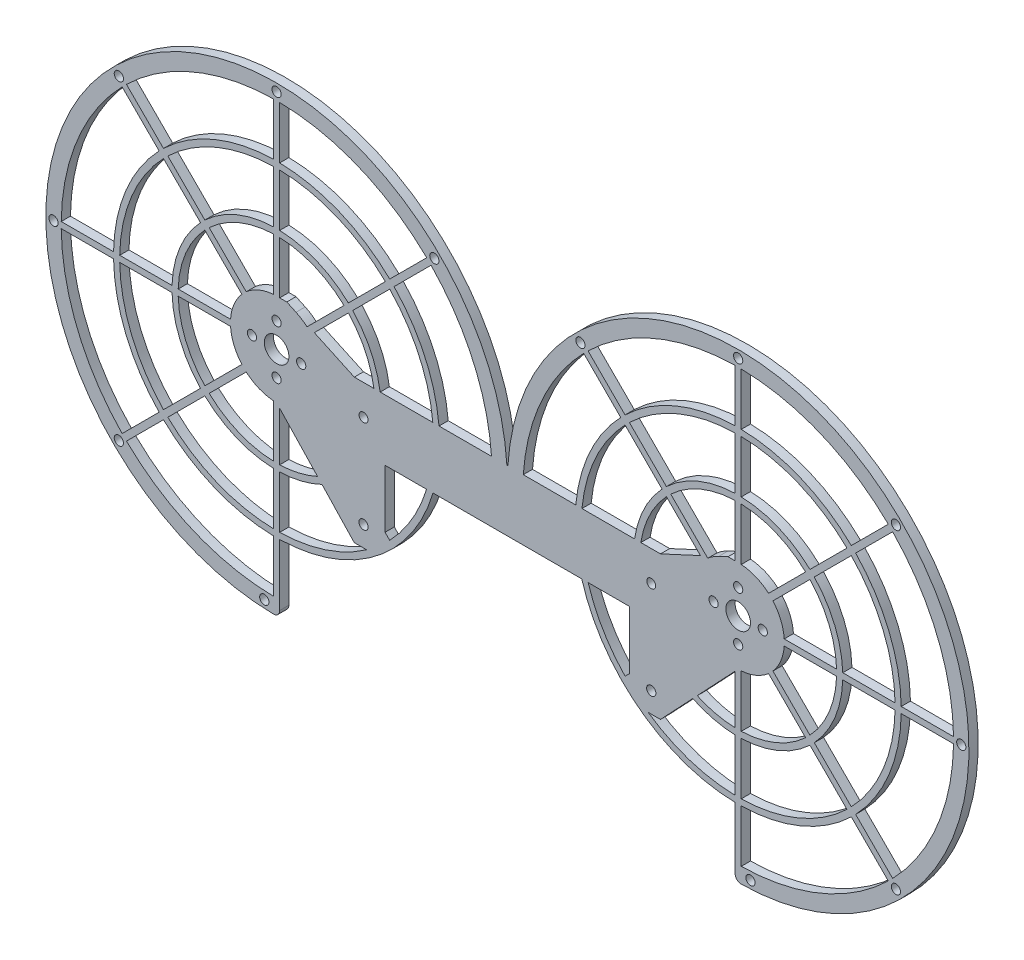
from build123d import *

# Parameters (mm, degrees)
SKETCH_1_R          = 1.5
SKETCH_1_R_2        = 4
SKETCH_1_R_3        = 1.459131994
EXTRUDE_1_DEPTH     = 3
SKETCH_5_R          = 1.5
CUT_EXTRUDE_2_DEPTH = 10
FILLET_1_R          = 2


with BuildPart() as part:
    # 草图1 → 凸台-拉伸1 (new body)
    with BuildSketch(Plane.XY):
        with BuildLine():
            Line((-125.75, -49.82198122), (-125.75, -27.819213381))
            ThreePointArc((-125.75, -27.819213381), (-94.617659732, -16.977345778), (-75.916939891, 10.171351817))
            Line((-75.916939891, 10.171351817), (-51.75, 10.171351817))
            Line((-51.75, 10.171351817), (-51.75, 30))
            Line((-51.75, 30), (-51.905600365, 30))
            ThreePointArc((-51.905600365, 30), (-181.804340524, 76.102870442), (-125.75, -49.82198122))
        make_face()
        with BuildLine():
            ThreePointArc((-127.75, -44.821504962), (-153.537840266, -39.500215459), (-175.535316881, -25.028178627))
            Line((-175.535316881, -25.028178627), (-163.512881209, -13.005742955))
            ThreePointArc((-163.512881209, -13.005742955), (-147.032221915, -23.794263406), (-127.75, -27.819213381))
            Line((-127.75, -27.819213381), (-127.75, -44.821504962))
        make_face(mode=Mode.SUBTRACT)
        with BuildLine():
            ThreePointArc((-127.75, -25.818843319), (-146.266855051, -21.946504341), (-162.098405973, -11.591267719))
            Line((-162.098405973, -11.591267719), (-150.0741229, 0.433015354))
            ThreePointArc((-150.0741229, 0.433015354), (-139.7612367, -6.240552289), (-127.75, -8.813939119))
            Line((-127.75, -8.813939119), (-127.75, -25.818843319))
        make_face(mode=Mode.SUBTRACT)
        with BuildLine():
            ThreePointArc((-176.949530444, -23.613965065), (-191.421567276, -1.616488449), (-196.742856778, 24.171351817))
            Line((-196.742856778, 24.171351817), (-179.740565198, 24.171351817))
            ThreePointArc((-179.740565198, 24.171351817), (-175.715615223, 4.889129901), (-164.927094772, -11.591529392))
            Line((-164.927094772, -11.591529392), (-176.949530444, -23.613965065))
        make_face(mode=Mode.SUBTRACT)
        with BuildLine():
            ThreePointArc((-163.512619536, -10.177054157), (-173.867856158, 5.654496766), (-177.740195136, 24.171351817))
            Line((-177.740195136, 24.171351817), (-160.735290936, 24.171351817))
            ThreePointArc((-160.735290936, 24.171351817), (-158.161904105, 12.160115116), (-151.488336463, 1.847228917))
            Line((-151.488336463, 1.847228917), (-163.512619536, -10.177054157))
        make_face(mode=Mode.SUBTRACT)
        with BuildLine():
            ThreePointArc((-127.75, -6.813019367), (-138.995869836, -4.392793224), (-148.659258975, 1.84787928))
            Line((-148.659258975, 1.84787928), (-136.625898463, 13.881239791))
            ThreePointArc((-136.625898463, 13.881239791), (-132.490251485, 11.313158829), (-127.75, 10.20472227))
            Line((-127.75, 10.20472227), (-127.75, -6.813019367))
        make_face(mode=Mode.SUBTRACT)
        with BuildLine():
            ThreePointArc((-150.073472537, 3.262092842), (-156.31414504, 12.925481981), (-158.734371183, 24.171351817))
            Line((-158.734371183, 24.171351817), (-141.716629547, 24.171351817))
            ThreePointArc((-141.716629547, 24.171351817), (-140.608192988, 19.431100331), (-138.040112025, 15.295453354))
            Line((-138.040112025, 15.295453354), (-150.073472537, 3.262092842))
        make_face(mode=Mode.SUBTRACT)
        with Locations((-134.75, 25.171351817)):
            Circle(SKETCH_1_R, mode=Mode.SUBTRACT)
        with BuildLine():
            ThreePointArc((-97.478573844, -16.592072502), (-110.926816524, -23.311911942), (-125.75, -25.818843319))
            Line((-125.75, -25.818843319), (-125.75, -8.813939119))
            ThreePointArc((-125.75, -8.813939119), (-118.698746874, -7.861621454), (-112.000098793, -5.462623021))
            Line((-112.000098793, -5.462623021), (-101.5, -16.592072502))
            Line((-101.5, -16.592072502), (-97.478573844, -16.592072502))
        make_face(mode=Mode.SUBTRACT)
        with Locations((-98.5, -10)):
            Circle(SKETCH_1_R, mode=Mode.SUBTRACT)
        with BuildLine():
            ThreePointArc((-113.444736922, -3.931396755), (-119.453694417, -5.985732849), (-125.75, -6.813019367))
            Line((-125.75, -6.813019367), (-125.75, 9.11141422))
            Line((-125.75, 9.11141422), (-113.444736922, -3.931396755))
        make_face(mode=Mode.SUBTRACT)
        with Locations((-126.75, 17.171351817)):
            Circle(SKETCH_1_R, mode=Mode.SUBTRACT)
        with Locations((-126.75, 25.171351817)):
            Circle(SKETCH_1_R_2, mode=Mode.SUBTRACT)
        with Locations((-118.75, 25.171351817)):
            Circle(SKETCH_1_R, mode=Mode.SUBTRACT)
        with Locations((-98.5, 20.171351817)):
            Circle(SKETCH_1_R_3, mode=Mode.SUBTRACT)
        with BuildLine():
            Line((-91.5, 10.171351817), (-78.005769572, 10.171351817))
            ThreePointArc((-78.005769572, 10.171351817), (-82.802647929, -0.705862985), (-89.987380464, -10.177054157))
            Line((-89.987380464, -10.177054157), (-91.5, -8.664434621))
            Line((-91.5, -8.664434621), (-91.5, 10.171351817))
        make_face(mode=Mode.SUBTRACT)
        with BuildLine():
            ThreePointArc((-196.742856778, 26.171351817), (-191.421567276, 51.959192082), (-176.949530444, 73.956668698))
            Line((-176.949530444, 73.956668698), (-164.927094772, 61.934233026))
            ThreePointArc((-164.927094772, 61.934233026), (-175.715615223, 45.453573732), (-179.740565198, 26.171351817))
            Line((-179.740565198, 26.171351817), (-196.742856778, 26.171351817))
        make_face(mode=Mode.SUBTRACT)
        with BuildLine():
            ThreePointArc((-177.740195136, 26.171351817), (-173.867856158, 44.688206867), (-163.512619536, 60.51975779))
            Line((-163.512619536, 60.51975779), (-151.488336463, 48.495474717))
            ThreePointArc((-151.488336463, 48.495474717), (-158.161904105, 38.182588517), (-160.735290936, 26.171351817))
            Line((-160.735290936, 26.171351817), (-177.740195136, 26.171351817))
        make_face(mode=Mode.SUBTRACT)
        with BuildLine():
            ThreePointArc((-158.734371183, 26.171351817), (-156.31414504, 37.417221652), (-150.073472537, 47.080610791))
            Line((-150.073472537, 47.080610791), (-138.040112025, 35.04725028))
            ThreePointArc((-138.040112025, 35.04725028), (-140.608192988, 30.911603302), (-141.716629547, 26.171351817))
            Line((-141.716629547, 26.171351817), (-158.734371183, 26.171351817))
        make_face(mode=Mode.SUBTRACT)
        with BuildLine():
            ThreePointArc((-148.659258975, 48.494824354), (-138.995869836, 54.735496857), (-127.75, 57.155723))
            Line((-127.75, 57.155723), (-127.75, 40.137981364))
            ThreePointArc((-127.75, 40.137981364), (-132.490251485, 39.029544804), (-136.625898463, 36.461463842))
            Line((-136.625898463, 36.461463842), (-148.659258975, 48.494824354))
        make_face(mode=Mode.SUBTRACT)
        with BuildLine():
            ThreePointArc((-162.098405973, 61.933971353), (-146.266855051, 72.289207975), (-127.75, 76.161546953))
            Line((-127.75, 76.161546953), (-127.75, 59.156642753))
            ThreePointArc((-127.75, 59.156642753), (-139.7612367, 56.583255922), (-150.0741229, 49.909688279))
            Line((-150.0741229, 49.909688279), (-162.098405973, 61.933971353))
        make_face(mode=Mode.SUBTRACT)
        with BuildLine():
            ThreePointArc((-175.535316881, 75.370882261), (-153.537840266, 89.842919093), (-127.75, 95.164208595))
            Line((-127.75, 95.164208595), (-127.75, 78.161917015))
            ThreePointArc((-127.75, 78.161917015), (-147.032221915, 74.13696704), (-163.512881209, 63.348446588))
            Line((-163.512881209, 63.348446588), (-175.535316881, 75.370882261))
        make_face(mode=Mode.SUBTRACT)
        with Locations((-126.75, 33.171351817)):
            Circle(SKETCH_1_R, mode=Mode.SUBTRACT)
        with BuildLine():
            ThreePointArc((-103.426527463, 47.080610791), (-97.974896909, 39.171117603), (-95.11640778, 30))
            Line((-95.11640778, 30), (-101.5, 30))
            Line((-101.5, 30), (-114.487036051, 36.020102203))
            Line((-114.487036051, 36.020102203), (-103.426527463, 47.080610791))
        make_face(mode=Mode.SUBTRACT)
        with BuildLine():
            Line((-125.75, 40.171351817), (-125.75, 57.155723))
            ThreePointArc((-125.75, 57.155723), (-114.504130164, 54.735496857), (-104.840741025, 48.494824354))
            Line((-104.840741025, 48.494824354), (-116.874101537, 36.461463842))
            ThreePointArc((-116.874101537, 36.461463842), (-118.575212841, 37.748030826), (-120.441601421, 38.780323393))
            Line((-120.441601421, 38.780323393), (-123.442436901, 40.171351817))
            Line((-123.442436901, 40.171351817), (-125.75, 40.171351817))
        make_face(mode=Mode.SUBTRACT)
        with BuildLine():
            ThreePointArc((-89.987380464, 60.51975779), (-80.399238319, 46.445911544), (-75.979101281, 30))
            Line((-75.979101281, 30), (-93.094626629, 30))
            ThreePointArc((-93.094626629, 30), (-96.123590101, 39.936954301), (-102.011663537, 48.495474717))
            Line((-102.011663537, 48.495474717), (-89.987380464, 60.51975779))
        make_face(mode=Mode.SUBTRACT)
        with BuildLine():
            ThreePointArc((-76.550469556, 73.956668698), (-62.835879051, 53.71929646), (-56.916740326, 30))
            Line((-56.916740326, 30), (-73.970419131, 30))
            ThreePointArc((-73.970419131, 30), (-78.550124267, 47.211587282), (-88.572905228, 61.934233026))
            Line((-88.572905228, 61.934233026), (-76.550469556, 73.956668698))
        make_face(mode=Mode.SUBTRACT)
        with BuildLine():
            Line((-125.75, 59.156642753), (-125.75, 76.161546953))
            ThreePointArc((-125.75, 76.161546953), (-107.233144949, 72.289207975), (-91.401594027, 61.933971353))
            Line((-91.401594027, 61.933971353), (-103.4258771, 49.909688279))
            ThreePointArc((-103.4258771, 49.909688279), (-113.7387633, 56.583255922), (-125.75, 59.156642753))
        make_face(mode=Mode.SUBTRACT)
        with BuildLine():
            Line((-125.75, 78.161917015), (-125.75, 95.164208595))
            ThreePointArc((-125.75, 95.164208595), (-99.962159734, 89.842919093), (-77.964683119, 75.370882261))
            Line((-77.964683119, 75.370882261), (-89.987118791, 63.348446588))
            ThreePointArc((-89.987118791, 63.348446588), (-106.467778085, 74.13696704), (-125.75, 78.161917015))
        make_face(mode=Mode.SUBTRACT)
    extrude(amount=EXTRUDE_1_DEPTH)

    # 草图5 → 切除-拉伸2 (cut)
    with BuildSketch(Plane.XY.offset(3)):
        with Locations((-130.75, -47.218219255)):
            Circle(SKETCH_5_R)
        with Locations((-178.015241636, -26.093889819)):
            Circle(SKETCH_5_R)
        with Locations((-199.25, 25.171351817)):
            Circle(SKETCH_5_R)
        with Locations((-178.015241636, 76.436593453)):
            Circle(SKETCH_5_R)
        with Locations((-126.75, 97.671351817)):
            Circle(SKETCH_5_R)
        with Locations((-75.484758364, 76.436593453)):
            Circle(SKETCH_5_R)
    extrude(amount=-CUT_EXTRUDE_2_DEPTH, mode=Mode.SUBTRACT)

    # 圆角1
    fillet_1_edges = [part.edges().sort_by_distance(p)[0] for p in [
        (-125.75, -49.82198122, 1.5),
    ]]
    fillet(fillet_1_edges, radius=FILLET_1_R)

    # 镜向1: part across plane


with BuildPart() as part_1:
    add(part.part)
    add(part.part.mirror(Plane(origin=(-51.75, 0, 0), x_dir=(0, 0, 1), z_dir=(1, 0, 0))))


solid = part_1.part
